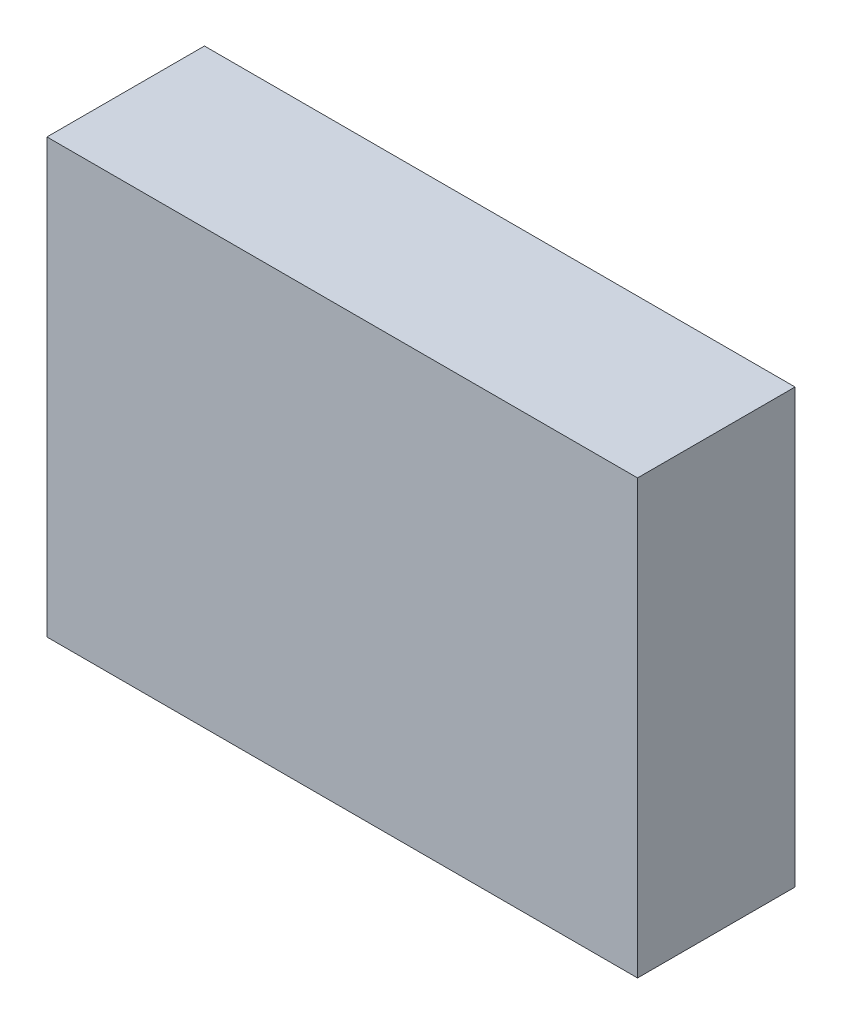
from build123d import *

# Parameters (mm, degrees)
SKETCH1_W           = 90
SKETCH1_H           = 24
BOSS_EXTRUDE1_DEPTH = 66


with BuildPart() as part:
    # Sketch1 → Boss-Extrude1 (new body)
    with BuildSketch(Plane(origin=(0, 0, 0), x_dir=(1, 0, 0), z_dir=(0, 1, 0))):
        Rectangle(SKETCH1_W, SKETCH1_H)
    extrude(amount=BOSS_EXTRUDE1_DEPTH)


solid = part.part
